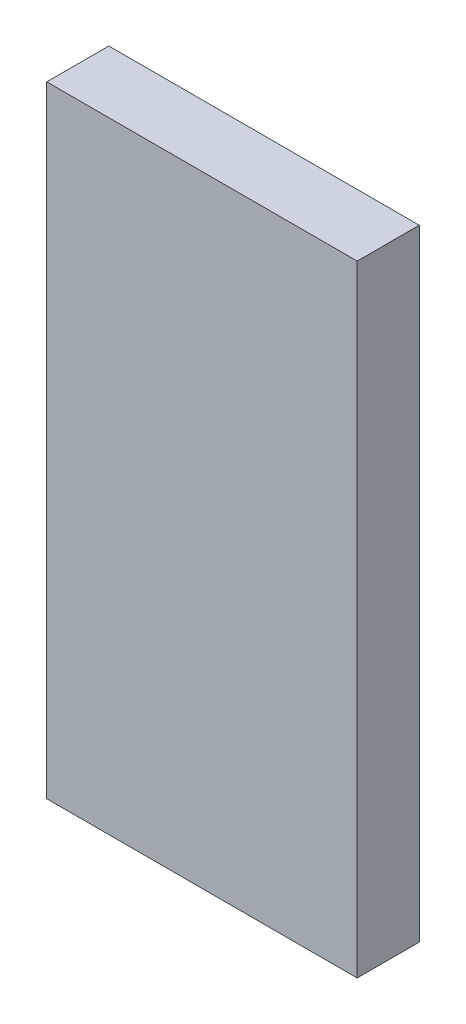
from build123d import *

# Parameters (mm, degrees)
SKETCH1_W           = 12.7
SKETCH1_H           = 25.4
BOSS_EXTRUDE1_DEPTH = 2.54


with BuildPart() as part:
    # Sketch1 → Boss-Extrude1 (new body)
    with BuildSketch(Plane.XY):
        with Locations((6.35, 12.7)):
            Rectangle(SKETCH1_W, SKETCH1_H)
    extrude(amount=BOSS_EXTRUDE1_DEPTH)


solid = part.part
